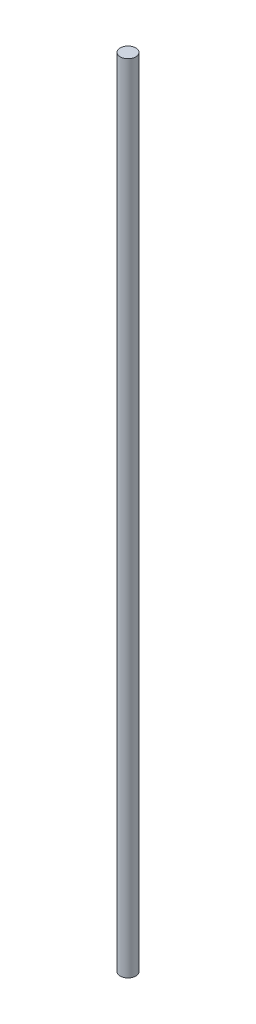
from build123d import *

# Parameters (mm, degrees)
SKETCH_1_R      = 3
EXTRUDE_1_DEPTH = 307


with BuildPart() as part:
    # Эскиз1 → Вытянуть1 (new body)
    with BuildSketch(Plane(origin=(0, 0, 0), x_dir=(1, 0, 0), z_dir=(0, 1, 0))):
        with Locations(Location((0, 0, 0), (0, 0, 270))):
            Circle(SKETCH_1_R)
    extrude(amount=EXTRUDE_1_DEPTH)


solid = part.part
